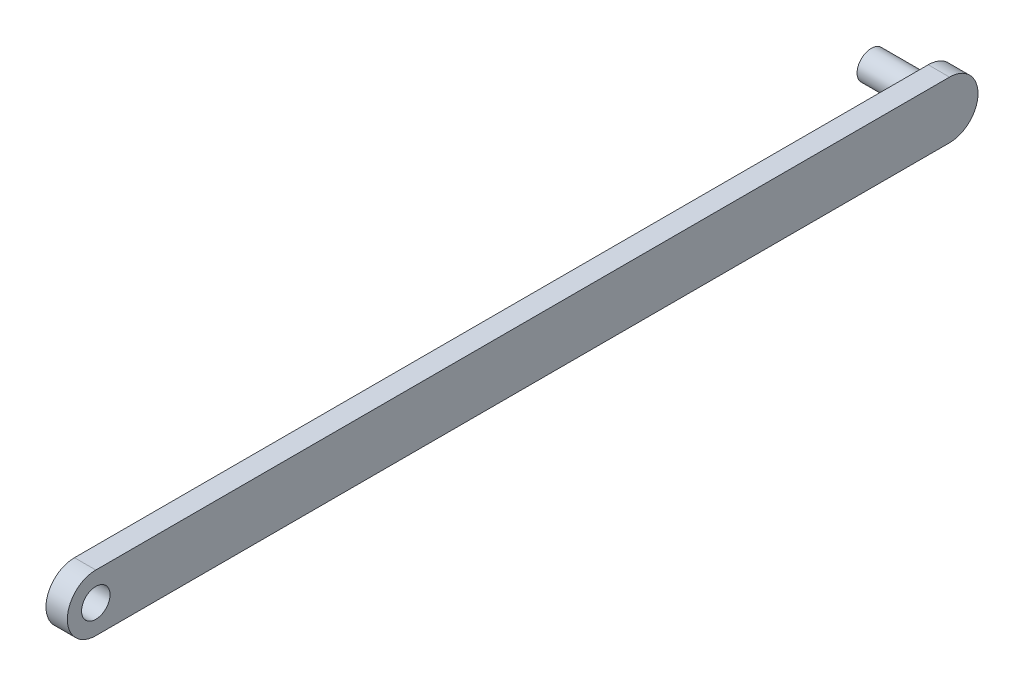
from build123d import *

# Parameters (mm, degrees)
SKETCH2_R           = 6.35
BOSS_EXTRUDE1_DEPTH = 9.525
SKETCH4_R           = 6.35
BOSS_EXTRUDE3_DEPTH = 25.4


with BuildPart() as part:
    # Sketch2 → Boss-Extrude1 (new body)
    with BuildSketch(Plane(origin=(0, 0, 0), x_dir=(0, 0, -1), z_dir=(1, 0, 0))):
        with BuildLine():
            Line((0, 12.7), (381, 12.7))
            ThreePointArc((381, 12.7), (393.7, 0), (381, -12.7))
            Line((381, -12.7), (0, -12.7))
            ThreePointArc((0, -12.7), (-12.7, 0), (0, 12.7))
        make_face()
        with Locations(Location((0, 0, 0), (0, 0, 180))):
            Circle(SKETCH2_R, mode=Mode.SUBTRACT)
    extrude(amount=BOSS_EXTRUDE1_DEPTH)

    # Sketch4 → Boss-Extrude3 (add)
    with BuildSketch(Plane.ZY):
        with Locations(Location((-381, 0, 0), (0, 0, 180))):
            Circle(SKETCH4_R)
    extrude(amount=BOSS_EXTRUDE3_DEPTH)


solid = part.part
